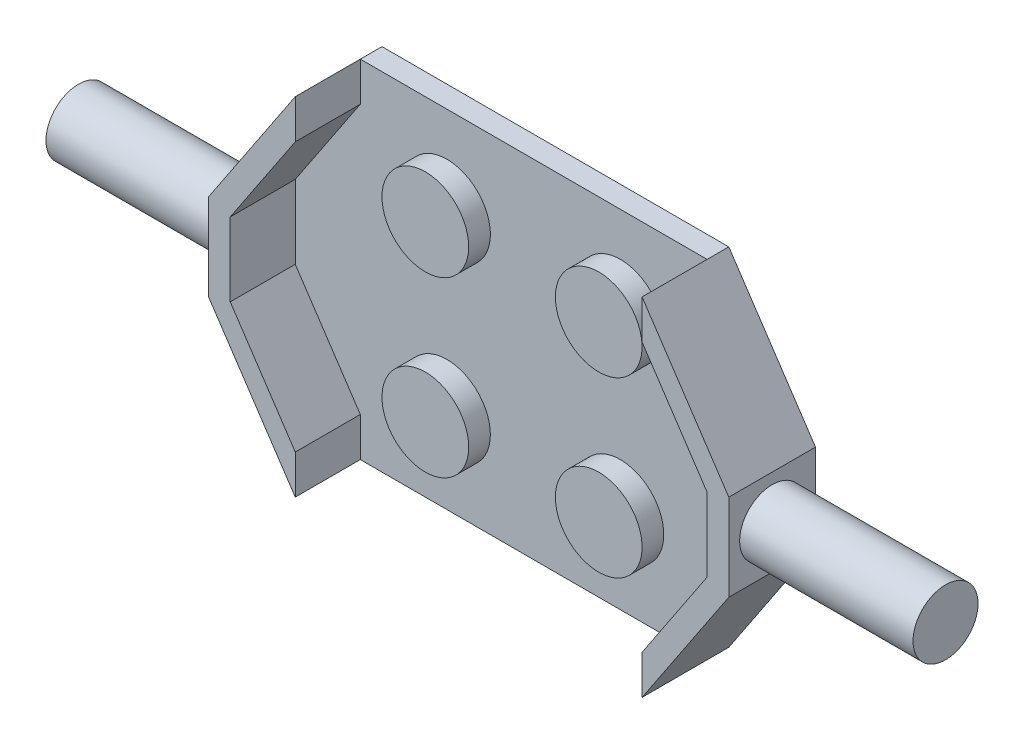
from build123d import *

# Parameters (mm, degrees)
BOSS_EXTRUDE1_DEPTH = 1
SKETCH3_R           = 2
BOSS_EXTRUDE2_DEPTH = 1
BOSS_EXTRUDE3_DEPTH = 3
SKETCH5_R           = 1.5
BOSS_EXTRUDE6_DEPTH = 8


with BuildPart() as part:
    # Sketch2 → Boss-Extrude1 (new body)
    with BuildSketch(Plane.XY):
        Polygon((-12, -2), (-12, 2), (-8, 8), (0, 8), (0, -8), (-8, -8), align=None)
    boss_extrude1 = extrude(amount=BOSS_EXTRUDE1_DEPTH)

    # Sketch3 → Boss-Extrude2 (add)
    with BuildSketch(Plane.XY.offset(1)):
        with Locations((-4, -4)):
            Circle(SKETCH3_R)
        with Locations(Location((-4, 4, 0), (0, 0, 180))):
            Circle(SKETCH3_R)
    boss_extrude2 = extrude(amount=BOSS_EXTRUDE2_DEPTH)

    # Sketch4 → Boss-Extrude3 (add)
    with BuildSketch(Plane.XY.offset(1)):
        Polygon((-12, -2), (-8, -8), (-8, -6.197224362), (-11, -1.697224362), (-11, 1.697224362), (-8, 6.197224362), (-8, 8), (-12, 2), align=None)
    boss_extrude3 = extrude(amount=BOSS_EXTRUDE3_DEPTH)

    # Sketch5 → Boss-Extrude6 (add)
    with BuildSketch(Plane.ZY.offset(12)):
        with Locations(Location((2, 0, 0), (0, 0, 180))):
            Circle(SKETCH5_R)
    boss_extrude6 = extrude(amount=BOSS_EXTRUDE6_DEPTH)

    # Mirror3: Boss-Extrude1, Boss-Extrude2, Boss-Extrude3, Boss-Extrude6 across plane
    add(boss_extrude1.mirror(Plane(origin=(0, 0, 0), x_dir=(0, 0, 1), z_dir=(1, 0, 0))))
    add(boss_extrude2.mirror(Plane(origin=(0, 0, 0), x_dir=(0, 0, 1), z_dir=(1, 0, 0))))
    add(boss_extrude3.mirror(Plane(origin=(0, 0, 0), x_dir=(0, 0, 1), z_dir=(1, 0, 0))))
    add(boss_extrude6.mirror(Plane(origin=(0, 0, 0), x_dir=(0, 0, 1), z_dir=(1, 0, 0))))


solid = part.part
